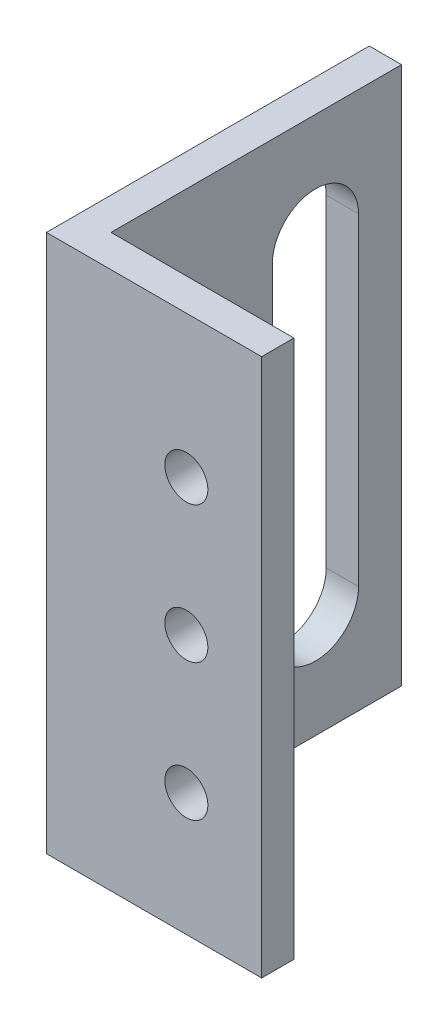
from build123d import *

# Parameters (mm, degrees)
SKETCH_1_W          = 3
SKETCH_1_H          = 27
SKETCH_1_H_2        = 3
SKETCH_1_W_2        = 17
EXTRUDE_1_DEPTH     = 50
SKETCH_2_R          = 2
CUT_EXTRUDE_1_DEPTH = 10
CUT_EXTRUDE_2_DEPTH = 10


with BuildPart() as part:
    # 草图1 → 凸台-拉伸1 (new body)
    with BuildSketch(Plane(origin=(0, 0, 0), x_dir=(1, 0, 0), z_dir=(0, 1, 0))):
        with Locations((0, 1.5)):
            Rectangle(SKETCH_1_W, SKETCH_1_H)
        with Locations((0, -13.5)):
            Rectangle(SKETCH_1_W, SKETCH_1_H_2)
        with Locations((10, -13.5)):
            Rectangle(SKETCH_1_W_2, SKETCH_1_H_2)
    extrude(amount=EXTRUDE_1_DEPTH)

    # 草图2 → 切除-拉伸1 (cut)
    with BuildSketch(Plane.XY.offset(15)):
        with Locations((11.5, 36.8)):
            Circle(SKETCH_2_R)
        with Locations((11.5, 24.1)):
            Circle(SKETCH_2_R)
        with Locations((11.5, 11.4)):
            Circle(SKETCH_2_R)
    extrude(amount=-CUT_EXTRUDE_1_DEPTH, mode=Mode.SUBTRACT)

    # 草图3 → 切除-拉伸2 (cut)
    with BuildSketch(Plane.ZY.offset(1.5)):
        with BuildLine():
            Line((-3, 40), (-3, 10))
            ThreePointArc((-3, 10), (-7, 6), (-11, 10))
            Line((-11, 10), (-11, 40))
            ThreePointArc((-11, 40), (-7, 44), (-3, 40))
        make_face()
    extrude(amount=-CUT_EXTRUDE_2_DEPTH, mode=Mode.SUBTRACT)


solid = part.part
